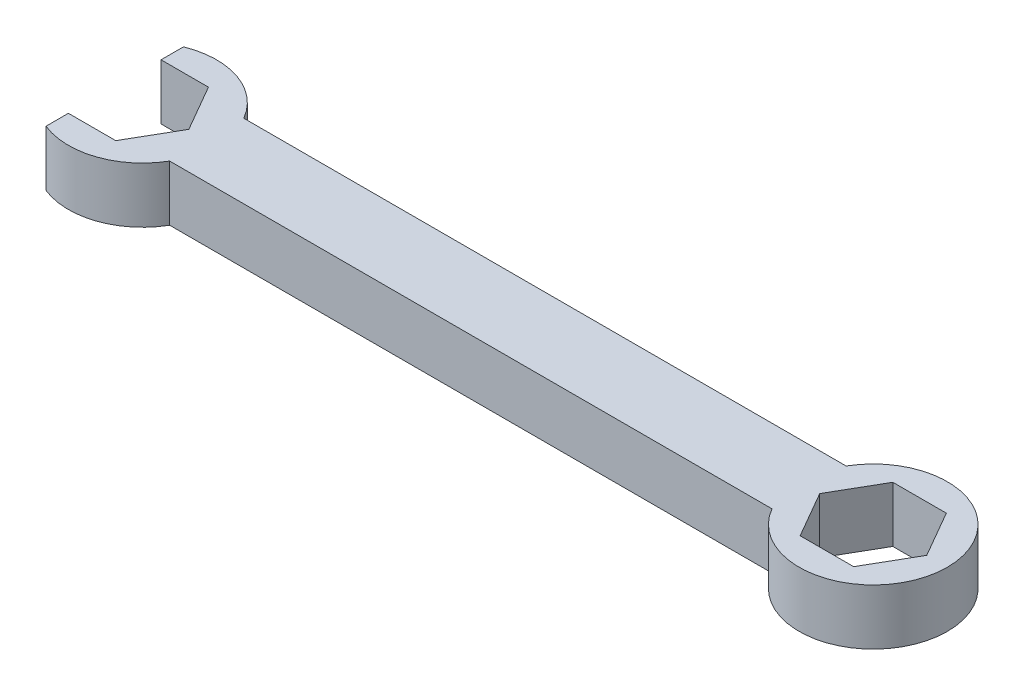
from build123d import *

# Parameters (mm, degrees)
BOSS_EXTRUDE1_DEPTH = 7.62


with BuildPart() as part:
    # Sketch1 → Boss-Extrude1 (new body)
    with BuildSketch(Plane(origin=(0, 0, 0), x_dir=(1, 0, 0), z_dir=(0, 1, 0))):
        with BuildLine():
            Line((-13.883314172, 5.08), (68.666685828, 5.08))
            ThreePointArc((68.666685828, 5.08), (87.62550393, 0), (68.666685828, -5.08))
            Line((68.666685828, -5.08), (-13.883314172, -5.08))
            ThreePointArc((-13.883314172, -5.08), (-19.3763981, -9.60717032), (-26.492132275, -9.418572079))
            Line((-26.492132275, -9.418572079), (-26.492132275, -6.35))
            Line((-26.492132275, -6.35), (-19.998306484, -6.35))
            Line((-19.998306484, -6.35), (-16.332132275, 0))
            Line((-16.332132275, 0), (-19.998306484, 6.35))
            Line((-19.998306484, 6.35), (-26.492132275, 6.35))
            Line((-26.492132275, 6.35), (-26.492132275, 9.418572079))
            ThreePointArc((-26.492132275, 9.418572079), (-19.3763981, 9.60717032), (-13.883314172, 5.08))
        make_face()
        Polygon((70.133155511, 0), (73.799329721, -6.35), (81.131678139, -6.35), (84.797852349, 0), (81.131678139, 6.35), (73.799329721, 6.35), align=None, mode=Mode.SUBTRACT)
    extrude(amount=BOSS_EXTRUDE1_DEPTH)


solid = part.part
